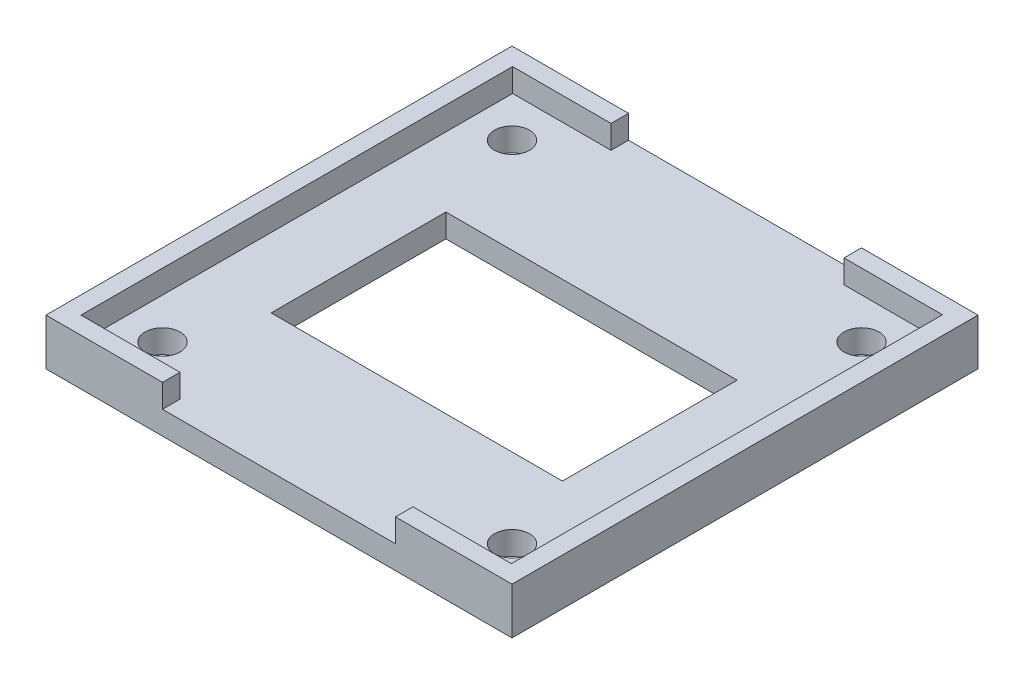
from build123d import *

# Parameters (mm, degrees)
SKETCH1_W           = 40
SKETCH1_H           = 40
SKETCH1_R           = 1.5
BOSS_EXTRUDE1_DEPTH = 2
BOSS_EXTRUDE2_DEPTH = 2
SKETCH3_W           = 25
SKETCH3_H           = 15
CUT_EXTRUDE1_DEPTH  = 2


with BuildPart() as part:
    # Sketch1 → Boss-Extrude1 (new body)
    with BuildSketch(Plane(origin=(0, 0, 0), x_dir=(1, 0, 0), z_dir=(0, 1, 0))):
        with Locations((0, 0.674157303)):
            Rectangle(SKETCH1_W, SKETCH1_H)
        with Locations(Location((-15, 15.674157303, 0), (0, 0, 270))):
            Circle(SKETCH1_R, mode=Mode.SUBTRACT)
        with Locations(Location((15, 15.674157303, 0), (0, 0, 270))):
            Circle(SKETCH1_R, mode=Mode.SUBTRACT)
        with Locations(Location((15, -14.325842697, 0), (0, 0, 90))):
            Circle(SKETCH1_R, mode=Mode.SUBTRACT)
        with Locations(Location((-15, -14.325842697, 0), (0, 0, 90))):
            Circle(SKETCH1_R, mode=Mode.SUBTRACT)
    extrude(amount=BOSS_EXTRUDE1_DEPTH)

    # Sketch2 → Boss-Extrude2 (add)
    with BuildSketch(Plane(origin=(0, 2, 0), x_dir=(1, 0, 0), z_dir=(0, 1, 0))):
        Polygon((-10, 19.174157303), (-10, 20.674157303), (-20, 20.674157303), (-20, -19.325842697), (-10, -19.325842697), (-10, -17.825842697), (-18.447674419, -17.825842697), (-18.499771919, -17.825842697), (-18.447674419, 19.174157303), align=None)
        Polygon((10, -19.325842697), (10, -17.825842697), (18.447674419, -17.825842697), (18.447674419, 19.174157303), (10, 19.174157303), (10, 20.674157303), (20, 20.674157303), (20, -19.325842697), align=None)
    extrude(amount=BOSS_EXTRUDE2_DEPTH)

    # Sketch3 → Cut-Extrude1 (cut)
    with BuildSketch(Plane.XZ):
        Rectangle(SKETCH3_W, SKETCH3_H)
    extrude(amount=-CUT_EXTRUDE1_DEPTH, mode=Mode.SUBTRACT)


solid = part.part
